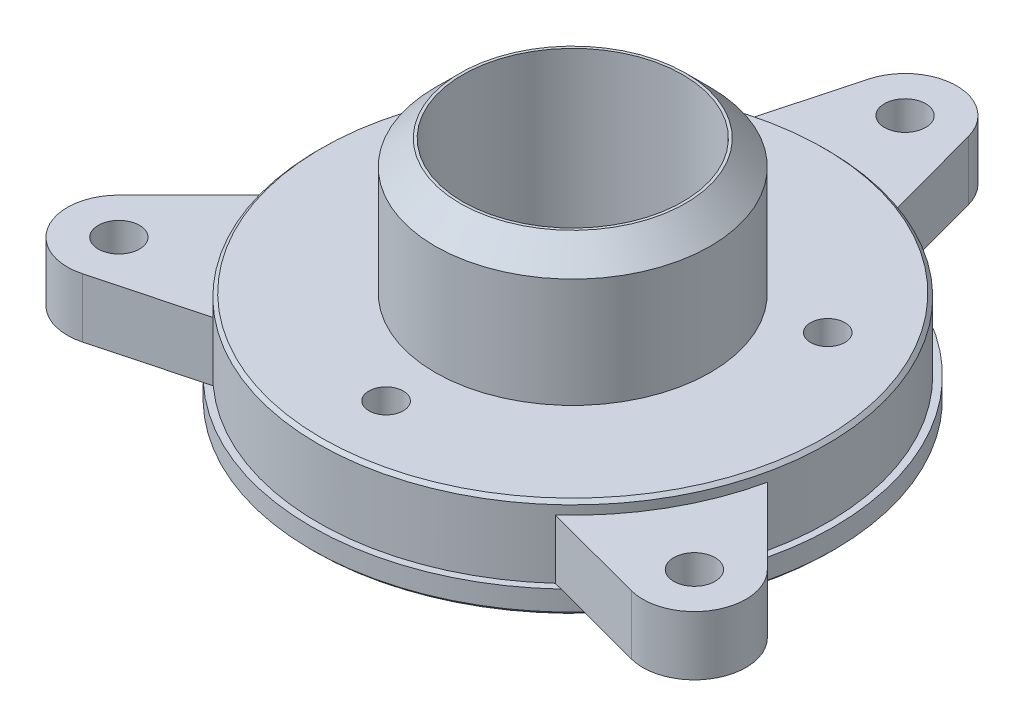
from build123d import *

# Parameters (mm, degrees)
SKETCH1_R               = 1.5
BOSS_EXTRUDE1_DEPTH     = 4.3
SKETCH3_R               = 18.5
BOSS_EXTRUDE2_DEPTH     = 0.9
CUT_EXTRUDE1_DEPTH      = 38.486507256
CUT_EXTRUDE1_DEPTH_BACK = 38.486507256
SKETCH2_R               = 1.25
SKETCH4_R               = 10
BOSS_EXTRUDE3_DEPTH     = 9.75
SKETCH5_R               = 8
CUT_EXTRUDE2_DEPTH      = 41.127929504
SKETCH6_R               = 19
BOSS_EXTRUDE4_DEPTH     = 1.7
SKETCH7_R               = 17.5
CUT_EXTRUDE3_DEPTH      = 4.4
CHAMFER1_SIZE           = 1.8
CHAMFER2_SIZE           = 0.25
CHAMFER3_SIZE           = 0.5


with BuildPart() as part:
    # Sketch1 → Boss-Extrude1 (new body)
    with BuildSketch(Plane(origin=(0, 0, 0), x_dir=(1, 0, 0), z_dir=(0, 1, 0))):
        with BuildLine():
            Line((-3.620168852, 25.128201147), (-5.65, 17.616114782))
            ThreePointArc((-5.65, 17.616114782), (-16.02146997, 9.25), (-18.081002917, -3.915013859))
            Line((-18.081002917, -3.915013859), (-23.57174497, -9.428942382))
            ThreePointArc((-23.57174497, -9.428942382), (-24.162108766, -13.95), (-19.951576119, -15.699258765))
            Line((-19.951576119, -15.699258765), (-12.431002917, -13.701100922))
            ThreePointArc((-12.431002917, -13.701100922), (0, -18.5), (12.431002917, -13.701100922))
            Line((12.431002917, -13.701100922), (19.951576119, -15.699258765))
            ThreePointArc((19.951576119, -15.699258765), (24.162108766, -13.95), (23.57174497, -9.428942382))
            Line((23.57174497, -9.428942382), (18.081002917, -3.915013859))
            ThreePointArc((18.081002917, -3.915013859), (16.02146997, 9.25), (5.65, 17.616114782))
            Line((5.65, 17.616114782), (3.620168852, 25.128201147))
            ThreePointArc((3.620168852, 25.128201147), (0, 27.9), (-3.620168852, 25.128201147))
        make_face()
        with Locations(Location((0, 24.15, 0), (0, 0, 90))):
            Circle(SKETCH1_R, mode=Mode.SUBTRACT)
        with Locations(Location((20.914513501, -12.075, 0), (0, 0, 90))):
            Circle(SKETCH1_R, mode=Mode.SUBTRACT)
        with Locations(Location((-20.914513501, -12.075, 0), (0, 0, 90))):
            Circle(SKETCH1_R, mode=Mode.SUBTRACT)
    extrude(amount=BOSS_EXTRUDE1_DEPTH)

    # Sketch3 → Boss-Extrude2 (add)
    with BuildSketch(Plane(origin=(0, 4.3, 0), x_dir=(1, 0, 0), z_dir=(0, 1, 0))):
        with Locations(Location((0, 0, 0), (0, 0, 72.217444278))):
            Circle(SKETCH3_R)
    extrude(amount=BOSS_EXTRUDE2_DEPTH)

    # Sketch2 → Cut-Extrude1 (cut, two sides: drawn at the far end of the back side and taken through both)
    with BuildSketch(Plane(origin=(0, 4.3, 0), x_dir=(1, 0, 0), z_dir=(0, 1, 0)).offset(-CUT_EXTRUDE1_DEPTH_BACK)):
        with Locations(Location((-11.75, 6.783865663, 0), (0, 0, 270))):
            Circle(SKETCH2_R)
        with Locations(Location((11.75, 6.783865663, 0), (0, 0, 270))):
            Circle(SKETCH2_R)
        with Locations(Location((0, -13.567731326, 0), (0, 0, 270))):
            Circle(SKETCH2_R)
    extrude(amount=CUT_EXTRUDE1_DEPTH + CUT_EXTRUDE1_DEPTH_BACK, mode=Mode.SUBTRACT)

    # Sketch4 → Boss-Extrude3 (add)
    with BuildSketch(Plane(origin=(0, 5.2, 0), x_dir=(1, 0, 0), z_dir=(0, 1, 0))):
        with Locations(Location((0, 0, 0), (0, 0, 270))):
            Circle(SKETCH4_R)
    extrude(amount=BOSS_EXTRUDE3_DEPTH)

    # Sketch5 → Cut-Extrude2 (cut, through all)
    with BuildSketch(Plane(origin=(0, 14.95, 0), x_dir=(1, 0, 0), z_dir=(0, 1, 0))):
        with Locations(Location((0, 0, 0), (0, 0, 270))):
            Circle(SKETCH5_R)
    extrude(amount=-CUT_EXTRUDE2_DEPTH, mode=Mode.SUBTRACT)

    # Sketch6 → Boss-Extrude4 (add)
    with BuildSketch(Plane.XZ):
        with Locations(Location((0, 0, 0), (0, 0, 46.812273556))):
            Circle(SKETCH6_R)
    extrude(amount=BOSS_EXTRUDE4_DEPTH)

    # Sketch7 → Cut-Extrude3 (cut)
    with BuildSketch(Plane(origin=(0, -1.7, 0), x_dir=(-1, 0, 0), z_dir=(0, -1, 0))):
        with Locations(Location((0, 0, 0), (0, 0, 90))):
            Circle(SKETCH7_R)
    extrude(amount=-CUT_EXTRUDE3_DEPTH, mode=Mode.SUBTRACT)

    # Chamfer1
    chamfer1_edges = [part.edges().sort_by_distance(p)[0] for p in [
        (0, 14.95, -10),
    ]]
    chamfer(chamfer1_edges, length=CHAMFER1_SIZE)

    # Chamfer2
    chamfer2_edges = [part.edges().sort_by_distance(p)[0] for p in [
        (0, -1.7, 17.5),
        (0, 2.7, 17.5),
        (-5.65, 5.2, 17.616114782),
        (-13.003427764, -1.7, -13.853189755),
    ]]
    chamfer(chamfer2_edges, length=CHAMFER2_SIZE)

    # Chamfer3
    chamfer3_edges = [part.edges().sort_by_distance(p)[0] for p in [
        (0, 0, -22.65),
        (20.914513501, 0, 13.575),
        (-20.914513501, 0, 13.575),
    ]]
    chamfer(chamfer3_edges, length=CHAMFER3_SIZE)


solid = part.part
